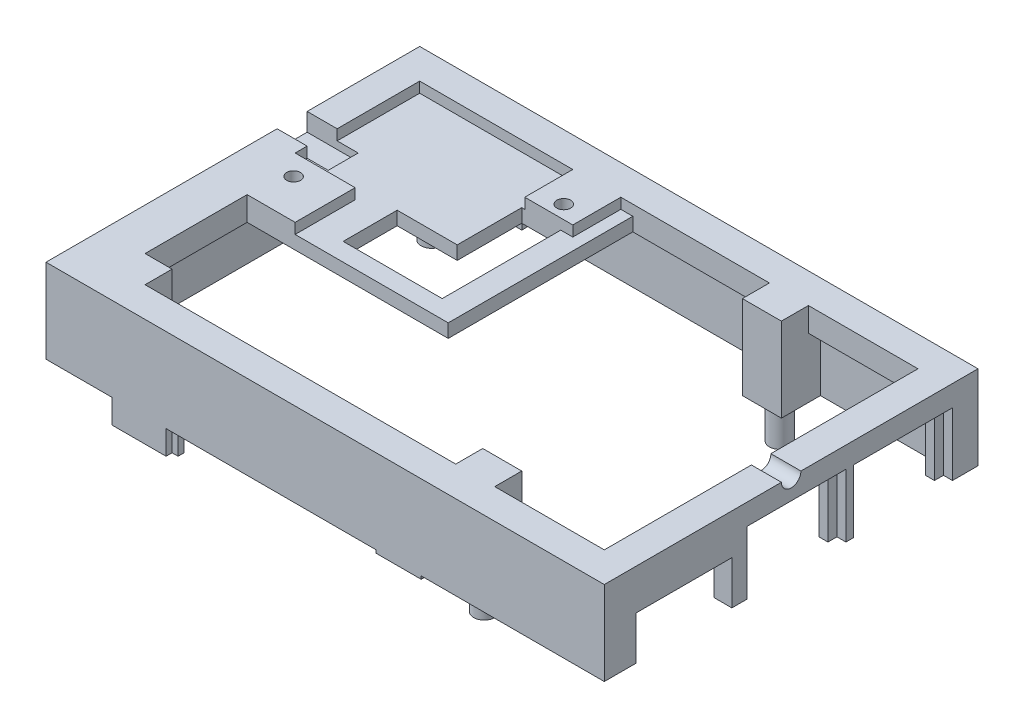
from build123d import *

# Parameters (mm, degrees)
SKETCH1_W               = 93
SKETCH1_H               = 62.25
BOSS_EXTRUDE1_DEPTH     = 4
CUT_EXTRUDE1_DEPTH      = 1.75
CUT_EXTRUDE2_DEPTH      = 112.933574052
SKETCH7_R               = 1.15
CUT_EXTRUDE3_DEPTH      = 112.982420495
SKETCH8_W               = 93
SKETCH8_H               = 62.25
SKETCH8_W_2             = 87
SKETCH8_H_2             = 56.25
BOSS_EXTRUDE3_DEPTH     = 10
BOSS_EXTRUDE7_START     = -14
SKETCH16_W              = 6.5
SKETCH16_H              = 4.5
SKETCH16_H_2            = 2
SKETCH16_W_2            = 4.5
BOSS_EXTRUDE7_DEPTH     = 14
SKETCH9_W               = 16
SKETCH9_H               = 7.25
SKETCH9_W_2             = 13.5
SKETCH9_H_2             = 9
CUT_EXTRUDE4_DEPTH      = 3
CUT_EXTRUDE5_DEPTH      = 1.5
CUT_EXTRUDE6_DEPTH      = 113.356853374
CUT_EXTRUDE6_DEPTH_BACK = 5
BOSS_EXTRUDE4_DEPTH     = 1
BOSS_EXTRUDE5_DEPTH     = 4
SKETCH14_W              = 5
SKETCH14_H              = 3
CUT_EXTRUDE8_DEPTH      = 8.5
BOSS_EXTRUDE6_DEPTH     = 0.5
SKETCH17_W              = 6.5
SKETCH17_H              = 4.5
CUT_EXTRUDE9_DEPTH      = 1.75
SKETCH18_R              = 1.75
BOSS_EXTRUDE8_DEPTH     = 6.4
SKETCH19_R              = 1.25
CUT_EXTRUDE10_DEPTH     = 4


with BuildPart() as part:
    # Sketch1 → Boss-Extrude1 (new body)
    with BuildSketch(Plane(origin=(0, 0, 0), x_dir=(1, 0, 0), z_dir=(0, 1, 0))):
        with Locations((46.5, 31.125)):
            Rectangle(SKETCH1_W, SKETCH1_H)
        Polygon((7, 5), (88, 5), (88, 57.25), (40.5, 57.25), (40.5, 26.5), (7, 26.5), align=None, mode=Mode.SUBTRACT)
    extrude(amount=BOSS_EXTRUDE1_DEPTH)

    # Sketch5 → Cut-Extrude1 (cut)
    with BuildSketch(Plane(origin=(0, 4, 0), x_dir=(1, 0, 0), z_dir=(0, 1, 0))):
        Polygon((40.5, 26.5), (15, 26.5), (15, 36.5), (5, 36.5), (5, 57.25), (30.5, 57.25), (30.5, 49.25), (38.5, 49.25), (38.5, 57.25), (40.5, 57.25), align=None)
    extrude(amount=-CUT_EXTRUDE1_DEPTH, mode=Mode.SUBTRACT)

    # Sketch6 → Cut-Extrude2 (cut, through all)
    with BuildSketch(Plane(origin=(0, 2.25, 0), x_dir=(1, 0, 0), z_dir=(0, 1, 0))):
        Polygon((30.5, 49.25), (30, 49.25), (30, 38.5), (20, 38.5), (20, 29.5), (28.25, 29.5), (36.5, 29.5), (36.5, 39.375), (36.5, 49.25), align=None)
    extrude(amount=-CUT_EXTRUDE2_DEPTH, mode=Mode.SUBTRACT)

    # Sketch7 → Cut-Extrude3 (cut, through all)
    with BuildSketch(Plane(origin=(0, 4, 0), x_dir=(1, 0, 0), z_dir=(0, 1, 0))):
        with Locations(Location((8.25, 33, 0), (0, 0, 270))):
            Circle(SKETCH7_R)
        with Locations(Location((34.75, 51.5, 0), (0, 0, 270))):
            Circle(SKETCH7_R)
    extrude(amount=-CUT_EXTRUDE3_DEPTH, mode=Mode.SUBTRACT)

    # Sketch8 → Boss-Extrude3 (add)
    with BuildSketch(Plane.XZ):
        with Locations((46.5, -31.125)):
            Rectangle(SKETCH8_W, SKETCH8_H)
        with Locations((46.5, -31.125)):
            Rectangle(SKETCH8_W_2, SKETCH8_H_2, mode=Mode.SUBTRACT)
    extrude(amount=BOSS_EXTRUDE3_DEPTH)

    # Sketch16 → Boss-Extrude7 (add)
    with BuildSketch(Plane(origin=(0, 4, 0), x_dir=(1, 0, 0), z_dir=(0, 1, 0)).offset(BOSS_EXTRUDE7_START)):
        with Locations((66.5, 7.25)):
            Rectangle(SKETCH16_W, SKETCH16_H)
        with Locations((66.5, 4)):
            Rectangle(SKETCH16_W, SKETCH16_H_2)
        with Locations((66.5, 55)):
            Rectangle(SKETCH16_W, SKETCH16_H)
        with Locations((66.5, 58.25)):
            Rectangle(SKETCH16_W, SKETCH16_H_2)
        with Locations((8.25, 58.25)):
            Rectangle(SKETCH16_W, SKETCH16_H_2)
        Polygon((5, 57.25), (5, 52.75), (7, 52.75), (11.5, 52.75), (11.5, 57.25), align=None)
        with Locations((9.25, 7.25)):
            Rectangle(SKETCH16_W_2, SKETCH16_H)
        Polygon((7, 5), (7, 9.5), (5, 9.5), (5, 3), (11.5, 3), (11.5, 5), align=None)
    extrude(amount=BOSS_EXTRUDE7_DEPTH)

    # Sketch9 → Cut-Extrude4 (cut)
    with BuildSketch(Plane(origin=(93, 0, 0), x_dir=(0, 0, -1), z_dir=(1, 0, 0))):
        with Locations((13.25, -6.375)):
            Rectangle(SKETCH9_W, SKETCH9_H)
        with Locations((32, -5.5)):
            Rectangle(SKETCH9_W_2, SKETCH9_H_2)
        with Locations((49.75, -5.5)):
            Rectangle(SKETCH9_W_2, SKETCH9_H_2)
    extrude(amount=-CUT_EXTRUDE4_DEPTH, mode=Mode.SUBTRACT)

    # Sketch10 → Cut-Extrude5 (cut)
    with BuildSketch(Plane(origin=(93, 0, 0), x_dir=(0, 0, -1), z_dir=(1, 0, 0))):
        Polygon((25.25, -10), (25.25, -1), (38.75, -1), (38.75, -10), (40.25, -10), (40.25, 0.5), (23.75, 0.5), (23.75, -10), align=None)
        Polygon((43, -10), (43, -1), (56.5, -1), (56.5, -10), (58, -10), (58, 0.5), (41.5, 0.5), (41.5, -10), align=None)
    extrude(amount=-CUT_EXTRUDE5_DEPTH, mode=Mode.SUBTRACT)

    # Sketch11 → Cut-Extrude6 (cut, two sides: drawn at the far end of the back side and taken through both)
    with BuildSketch(Plane(origin=(93, 0, 0), x_dir=(0, 0, -1), z_dir=(1, 0, 0)).offset(-CUT_EXTRUDE6_DEPTH_BACK)):
        with BuildLine():
            Line((29.5, 85.233770081), (29.5, 4))
            ThreePointArc((29.5, 4), (31.125, 2.375), (32.75, 4))
            Line((32.75, 4), (32.75, 85.233770081))
            Line((32.75, 85.233770081), (32.75, 247.701310244))
            Line((32.75, 247.701310244), (29.5, 247.701310244))
            Line((29.5, 247.701310244), (29.5, 85.233770081))
        make_face()
    extrude(amount=CUT_EXTRUDE6_DEPTH + CUT_EXTRUDE6_DEPTH_BACK, mode=Mode.SUBTRACT)

    # Sketch12 → Boss-Extrude4 (add)
    with BuildSketch(Plane(origin=(0, -10, 0), x_dir=(-1, 0, 0), z_dir=(0, -1, 0))):
        Polygon((-20, 62.25), (-14, 62.25), (-14, 61.25), (-13, 61.25), (-13, 60.25), (-14, 60.25), (-14, 59.25), (-20, 59.25), (-20, 60.25), (-21, 60.25), (-21, 61.25), (-20, 61.25), align=None)
    extrude(amount=BOSS_EXTRUDE4_DEPTH)

    # Sketch13 → Boss-Extrude5 (add)
    with BuildSketch(Plane.XZ.offset(10)):
        Polygon((20, -3), (11, -3), (11, -2), (10, -2), (10, -1), (11, -1), (11, 0), (20, 0), (20, -1), (21, -1), (21, -2), (20, -2), align=None)
    extrude(amount=BOSS_EXTRUDE5_DEPTH)

    # Sketch14 → Cut-Extrude8 (cut)
    with BuildSketch(Plane.ZY):
        with Locations((-41, 2.5)):
            Rectangle(SKETCH14_W, SKETCH14_H)
    extrude(amount=-CUT_EXTRUDE8_DEPTH, mode=Mode.SUBTRACT)

    # Sketch15 → Boss-Extrude6 (add)
    with BuildSketch(Plane.XZ.offset(10)):
        Polygon((62.5, -3), (55, -3), (55, -2), (54, -2), (54, -1), (55, -1), (55, 0), (62.5, 0), (62.5, -1), (63.5, -1), (63.5, -2), (62.5, -2), align=None)
    extrude(amount=BOSS_EXTRUDE6_DEPTH)

    # Sketch17 → Cut-Extrude9 (cut)
    with BuildSketch(Plane(origin=(0, 4, 0), x_dir=(1, 0, 0), z_dir=(0, 1, 0))):
        with Locations((8.25, 55)):
            Rectangle(SKETCH17_W, SKETCH17_H)
    extrude(amount=-CUT_EXTRUDE9_DEPTH, mode=Mode.SUBTRACT)

    # Sketch18 → Boss-Extrude8 (add)
    with BuildSketch(Plane(origin=(0, -10, 0), x_dir=(-1, 0, 0), z_dir=(0, -1, 0))):
        with Locations(Location((-8.5, 55.75, 0), (0, 0, 90))):
            Circle(SKETCH18_R)
        with Locations(Location((-66.5, 55.75, 0), (0, 0, 90))):
            Circle(SKETCH18_R)
        with Locations(Location((-66.5, 6.5, 0), (0, 0, 270))):
            Circle(SKETCH18_R)
        with Locations(Location((-8.5, 6.5, 0), (0, 0, 270))):
            Circle(SKETCH18_R)
    extrude(amount=BOSS_EXTRUDE8_DEPTH)

    # Sketch19 → Cut-Extrude10 (cut)
    with BuildSketch(Plane.XZ.offset(16.4)):
        with Locations(Location((8.5, -6.5, 0), (0, 0, 270))):
            Circle(SKETCH19_R)
        with Locations(Location((8.5, -55.75, 0), (0, 0, 270))):
            Circle(SKETCH19_R)
        with Locations(Location((66.5, -55.75, 0), (0, 0, 270))):
            Circle(SKETCH19_R)
        with Locations(Location((66.5, -6.5, 0), (0, 0, 270))):
            Circle(SKETCH19_R)
    extrude(amount=-CUT_EXTRUDE10_DEPTH, mode=Mode.SUBTRACT)


solid = part.part
